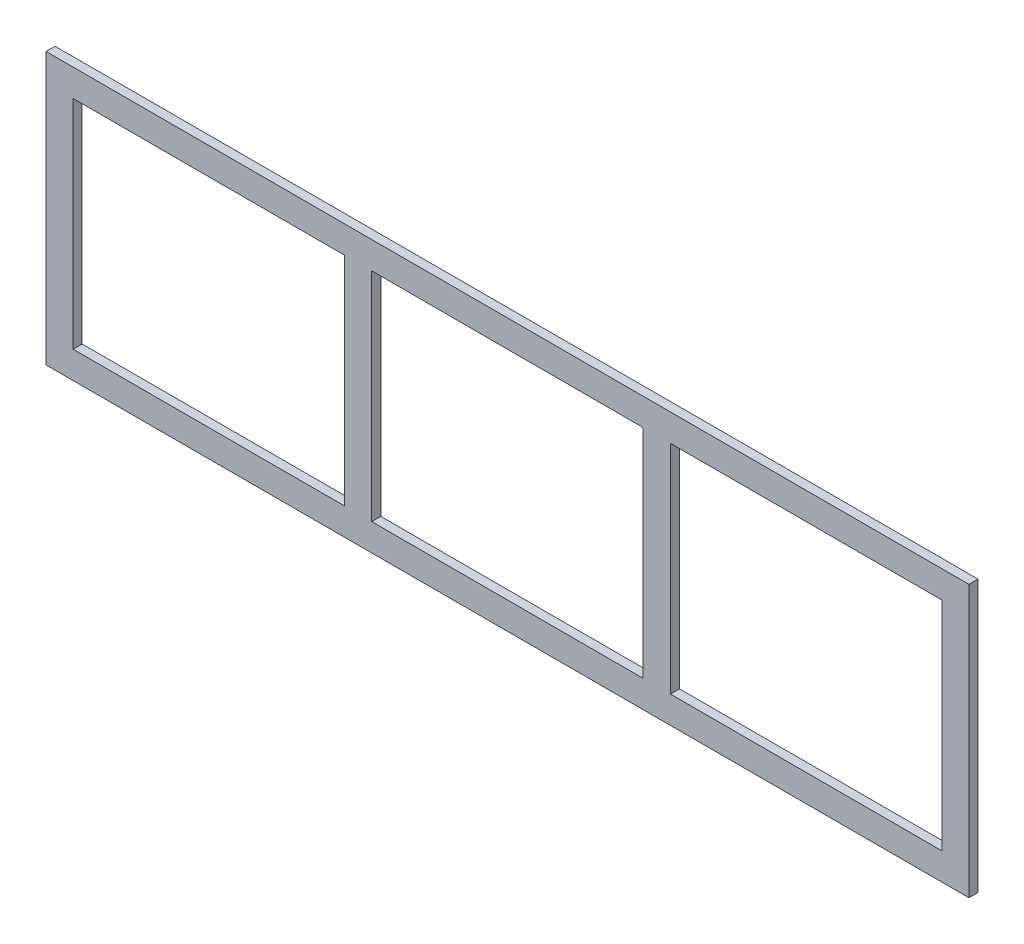
from build123d import *

# Parameters (mm, degrees)
SKETCH1_W           = 5100
SKETCH1_H           = 1500
SKETCH1_W_2         = 1500
SKETCH1_H_2         = 1200
BOSS_EXTRUDE1_DEPTH = 50


with BuildPart() as part:
    # Sketch1 → Boss-Extrude1 (new body)
    with BuildSketch(Plane.XY):
        Rectangle(SKETCH1_W, SKETCH1_H)
        with Locations((1650, 0)):
            Rectangle(SKETCH1_W_2, SKETCH1_H_2, mode=Mode.SUBTRACT)
        with Locations((-1650, 0)):
            Rectangle(SKETCH1_W_2, SKETCH1_H_2, mode=Mode.SUBTRACT)
        Rectangle(SKETCH1_W_2, SKETCH1_H_2, mode=Mode.SUBTRACT)
    extrude(amount=BOSS_EXTRUDE1_DEPTH)


solid = part.part
